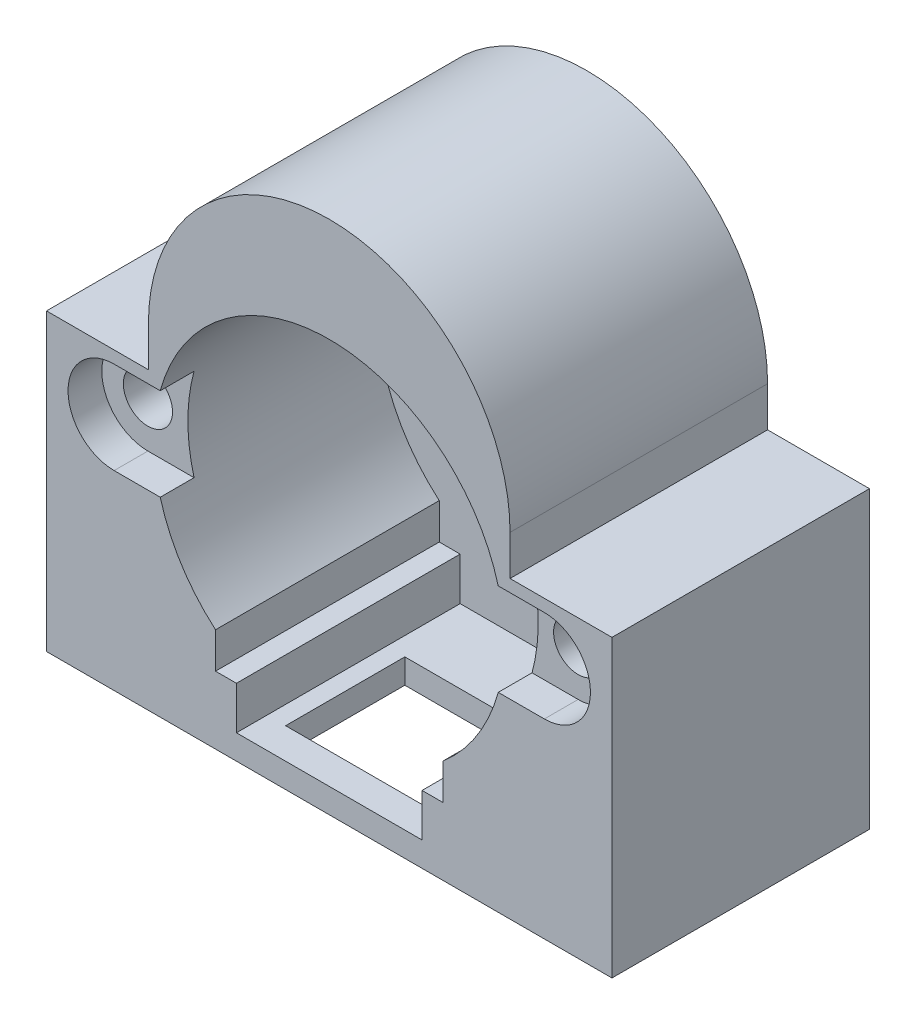
from build123d import *

# Parameters (mm, degrees)
BOSS_EXTRUDE1_DEPTH     = 20.95
BOSS_EXTRUDE2_DEPTH     = 2.75
SKETCH6_R               = 2
CUT_EXTRUDE2_DEPTH      = 10
CUT_EXTRUDE3_DEPTH      = 2.75
CUT_EXTRUDE4_DEPTH      = 39.517830206
CUT_EXTRUDE4_DEPTH_BACK = 39.517830206
SKETCH8_W               = 8.290514233
SKETCH8_H               = 3.25
CUT_EXTRUDE5_REACH      = 64.495
SKETCH9_W               = 12.1
SKETCH9_H               = 9.7


with BuildPart() as part:
    # Sketch2 → Boss-Extrude1 (new body)
    with BuildSketch(Plane.XY):
        with BuildLine():
            Line((-14.709485767, 8), (-23, 8))
            Line((-23, 8), (-23, -19.25))
            Line((-23, -19.25), (23, -19.25))
            Line((23, -19.25), (23, 8))
            Line((23, 8), (14.709485767, 8))
            ThreePointArc((14.709485767, 8), (0, 22.709485767), (-14.709485767, 8))
        make_face()
        with BuildLine():
            Line((-7.55, -13.758885964), (-7.55, -17.25))
            Line((-7.55, -17.25), (7.55, -17.25))
            Line((7.55, -17.25), (7.55, -13.758885964))
            Line((7.55, -13.758885964), (9.25, -13.758885964))
            Line((9.25, -13.758885964), (9.25, -10.839741694))
            ThreePointArc((9.25, -10.839741694), (0, 14.25), (-9.25, -10.839741694))
            Line((-9.25, -10.839741694), (-9.25, -13.758885964))
            Line((-9.25, -13.758885964), (-7.55, -13.758885964))
        make_face(mode=Mode.SUBTRACT)
    extrude(amount=BOSS_EXTRUDE1_DEPTH)

    # Sketch3 → Boss-Extrude2 (add)
    with BuildSketch(Plane.XY):
        with BuildLine():
            Line((-14.709485767, 8), (-23, 8))
            Line((-23, 8), (-23, -19.25))
            Line((-23, -19.25), (23, -19.25))
            Line((23, -19.25), (23, 8))
            Line((23, 8), (14.709485767, 8))
            ThreePointArc((14.709485767, 8), (0, 22.709485767), (-14.709485767, 8))
        make_face()
    extrude(amount=BOSS_EXTRUDE2_DEPTH)

    # Sketch6 → Cut-Extrude2 (cut)
    with BuildSketch(Plane.XY.offset(20.95)):
        with Locations((-17.5, 0)):
            Circle(SKETCH6_R)
        with Locations((17.5, 0)):
            Circle(SKETCH6_R)
    extrude(amount=-CUT_EXTRUDE2_DEPTH, mode=Mode.SUBTRACT)

    # Sketch7 → Cut-Extrude3 (cut)
    with BuildSketch(Plane.XY.offset(20.95)):
        with BuildLine():
            Line((-17.5, 3.75), (17.5, 3.75))
            ThreePointArc((17.5, 3.75), (21.25, 0), (17.5, -3.75))
            Line((17.5, -3.75), (-17.5, -3.75))
            ThreePointArc((-17.5, -3.75), (-21.25, 0), (-17.5, 3.75))
        make_face()
    extrude(amount=-CUT_EXTRUDE3_DEPTH, mode=Mode.SUBTRACT)

    # Sketch8 → Cut-Extrude4 (cut, two sides: drawn at the far end of the back side and taken through both)
    with BuildSketch(Plane.XY.offset(20.95).offset(-CUT_EXTRUDE4_DEPTH_BACK)):
        with Locations((-18.854742884, 6.375)):
            Rectangle(SKETCH8_W, SKETCH8_H)
        with Locations((18.854742884, 6.375)):
            Rectangle(SKETCH8_W, SKETCH8_H)
    extrude(amount=CUT_EXTRUDE4_DEPTH + CUT_EXTRUDE4_DEPTH_BACK, mode=Mode.SUBTRACT)

    # Sketch9 → Cut-Extrude5 (cut, up to next)
    with BuildSketch(Plane(origin=(0, -19.25, -19.25), x_dir=(-1, 0, 0), z_dir=(0, 1, 0)), mode=Mode.PRIVATE) as cut_extrude5_sk1:
        with Locations((0, 32.85)):
            Rectangle(SKETCH9_W, SKETCH9_H)
    cut_extrude5_tool1 = extrude(cut_extrude5_sk1.sketch, amount=CUT_EXTRUDE5_REACH, mode=Mode.PRIVATE) & part.part
    add(cut_extrude5_tool1.solids().sort_by_distance((0, -19.25, 13.6))[0], mode=Mode.SUBTRACT)


solid = part.part
